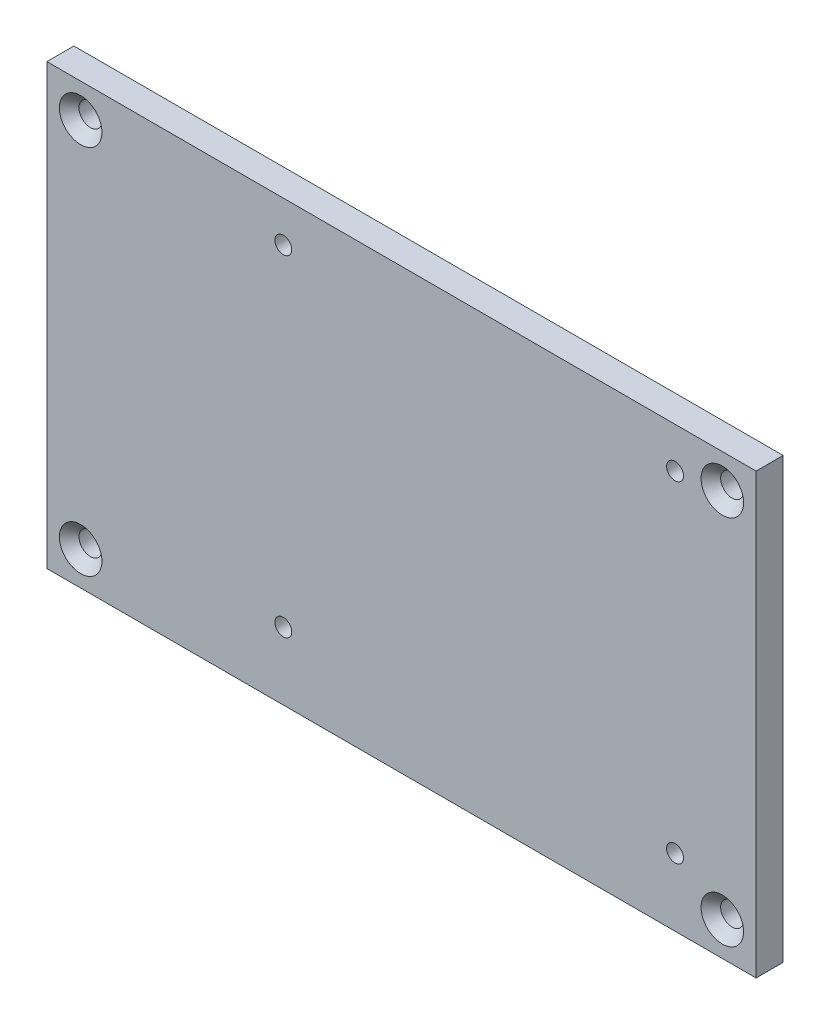
from build123d import *

# Parameters (mm, degrees)
SKETCH_1_W                     = 105
SKETCH_1_H                     = 65
EXTRUDE_1_DEPTH                = 4
HOLE_WIZARD_M3_1_D             = 2.5
HOLE_WIZARD_M3_1_2_D           = 3.4
HOLE_WIZARD_M3_1_2_CSINK_D     = 6.3
HOLE_WIZARD_M3_1_2_CSINK_ANGLE = 90


with BuildPart() as part:
    # 草圖1 → 填料-伸長1 (new body)
    with BuildSketch(Plane.XY):
        Rectangle(SKETCH_1_W, SKETCH_1_H)
    extrude(amount=EXTRUDE_1_DEPTH)

    # Hole Wizard M3 _1 (through all)
    with Locations(Plane.XY.offset(4)):
        with Locations((40.5, 26.5), (40.5, -22.5), (-17.5, -22.5), (-17.5, 26.5)):
            Hole(HOLE_WIZARD_M3_1_D / 2)

    # Hole Wizard M3 _1 2 (through all)
    with Locations(Plane.XY.offset(4)):
        with Locations((-47.5, 27.5), (-47.5, -27.5), (47.5, 27.5), (47.5, -27.5)):
            CounterSinkHole(HOLE_WIZARD_M3_1_2_D / 2, HOLE_WIZARD_M3_1_2_CSINK_D / 2, counter_sink_angle=HOLE_WIZARD_M3_1_2_CSINK_ANGLE)


solid = part.part
